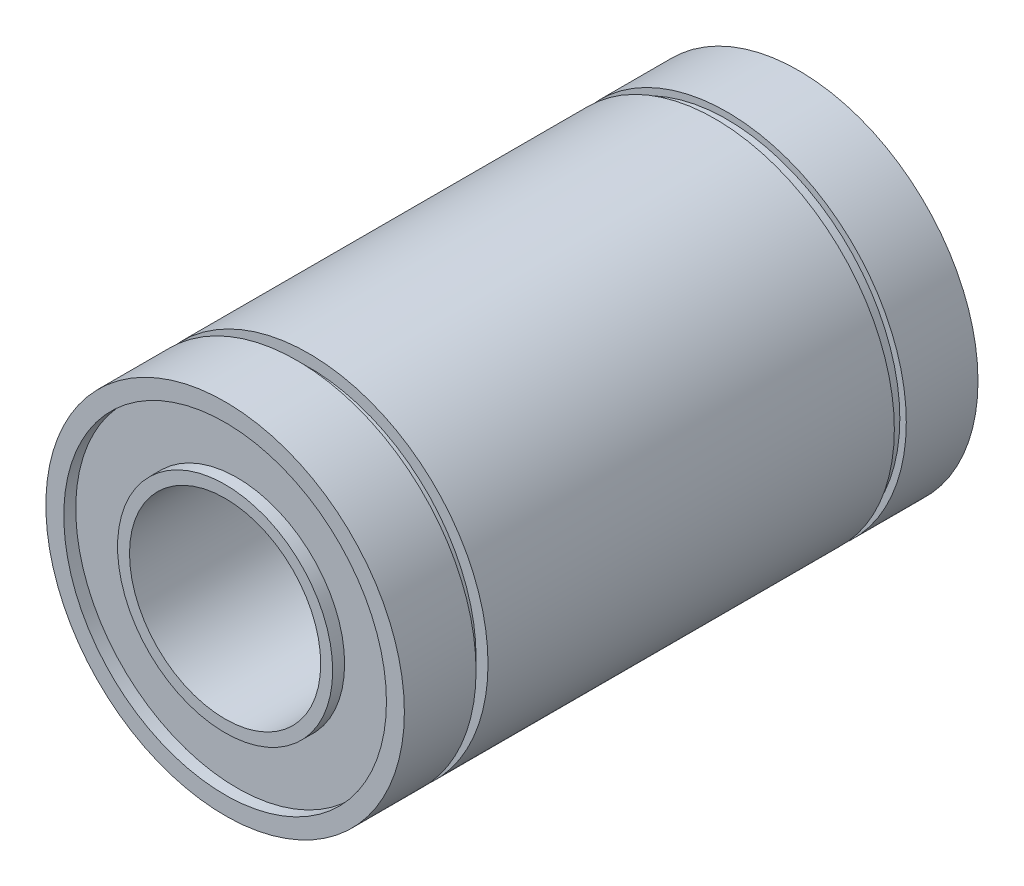
from build123d import *


with BuildPart() as part:
    # Sketch1 → Revolve1 (revolve)
    with BuildSketch(Plane(origin=(0, 0, 0), x_dir=(1, 0, 0), z_dir=(0, 1, 0))):
        Polygon((4, 0), (4.5, 0), (4.5, 0.5), (6.75, 0.5), (6.75, 0), (7.5, 0), (7.5, 3), (7, 3), (7, 3.5), (7.5, 3.5), (7.5, 20.5), (7.229844059, 20.5), (7.229844059, 21), (7.5, 21), (7.5, 24), (6.75, 24), (6.75, 23.5), (4.5, 23.5), (4.5, 24), (4, 24), align=None)
    revolve(axis=Axis((0, 0, 0), (0, 0, -1)))


solid = part.part
